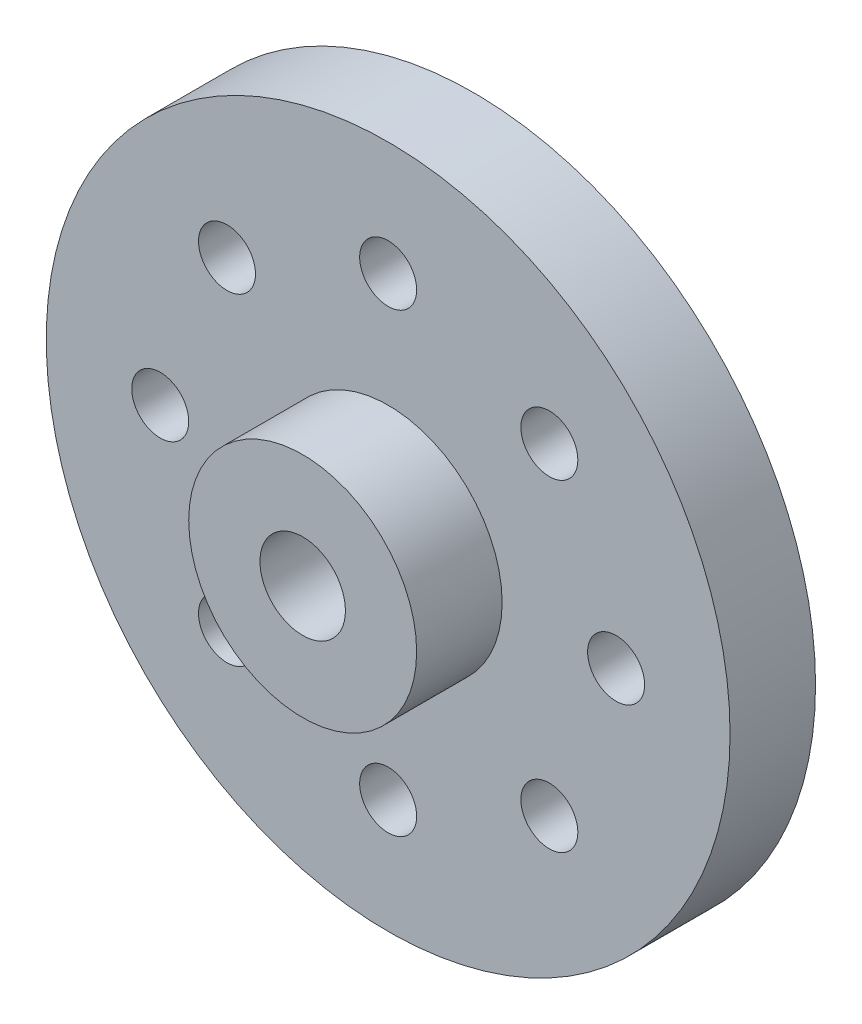
from build123d import *

# Parameters (mm, degrees)
SKETCH_1_R      = 12
SKETCH_1_R_2    = 1
SKETCH_1_R_3    = 1.5
EXTRUDE_1_DEPTH = 3
SKETCH_2_R      = 4
SKETCH_2_R_2    = 1.5
EXTRUDE_2_DEPTH = 3


with BuildPart() as part:
    # 草图1 → 凸台-拉伸1 (new body)
    with BuildSketch(Plane.XY):
        Circle(SKETCH_1_R)
        with Locations((0, 8)):
            Circle(SKETCH_1_R_2, mode=Mode.SUBTRACT)
        with Locations((5.656854249, 5.656854249)):
            Circle(SKETCH_1_R_2, mode=Mode.SUBTRACT)
        with Locations((8, 0)):
            Circle(SKETCH_1_R_2, mode=Mode.SUBTRACT)
        with Locations((5.656854249, -5.656854249)):
            Circle(SKETCH_1_R_2, mode=Mode.SUBTRACT)
        with Locations((0, -8)):
            Circle(SKETCH_1_R_2, mode=Mode.SUBTRACT)
        with Locations((-5.656854249, -5.656854249)):
            Circle(SKETCH_1_R_2, mode=Mode.SUBTRACT)
        with Locations((-8, 0)):
            Circle(SKETCH_1_R_2, mode=Mode.SUBTRACT)
        with Locations((-5.656854249, 5.656854249)):
            Circle(SKETCH_1_R_2, mode=Mode.SUBTRACT)
        Circle(SKETCH_1_R_3, mode=Mode.SUBTRACT)
    extrude(amount=EXTRUDE_1_DEPTH)

    # 草图2 → 凸台-拉伸2 (add)
    with BuildSketch(Plane.XY.offset(3)):
        Circle(SKETCH_2_R)
        Circle(SKETCH_2_R_2, mode=Mode.SUBTRACT)
    extrude(amount=EXTRUDE_2_DEPTH)


solid = part.part
